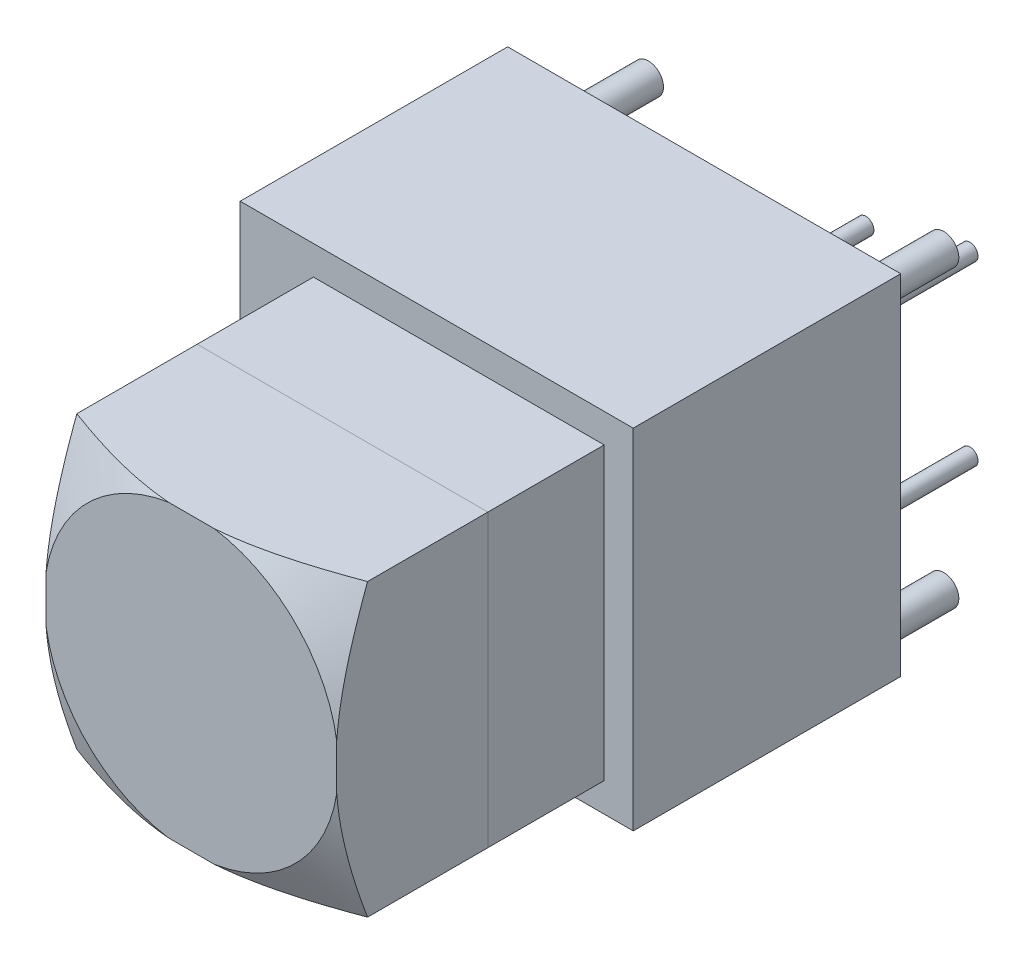
from build123d import *

# Parameters (mm, degrees)
SKETCH1_W           = 16.9
SKETCH1_H           = 15
BOSS_EXTRUDE1_DEPTH = 11.5
SKETCH3_R           = 0.65
BOSS_EXTRUDE2_DEPTH = 3
SKETCH3_3_R         = 0.35
BOSS_EXTRUDE3_DEPTH = 6
SKETCH6_W           = 12.5
SKETCH6_H           = 12.5
BOSS_EXTRUDE4_DEPTH = 5
SKETCH7_W           = 12.5
SKETCH7_H           = 12.5
BOSS_EXTRUDE5_DEPTH = 6.5


with BuildPart() as part:
    # Sketch1 → Boss-Extrude1 (new body)
    with BuildSketch(Plane.XY):
        Rectangle(SKETCH1_W, SKETCH1_H)
    extrude(amount=BOSS_EXTRUDE1_DEPTH)

    # Sketch3 → Boss-Extrude2 (add)
    with BuildSketch(Plane(origin=(0, 0, 0), x_dir=(-1, 0, 0), z_dir=(0, 0, -1))):
        with Locations((-7.3, -6.35)):
            Circle(SKETCH3_R)
        with Locations((-7.3, 6.35)):
            Circle(SKETCH3_R)
        with Locations((5.4, 6.35)):
            Circle(SKETCH3_R)
        with Locations((5.4, -6.35)):
            Circle(SKETCH3_R)
    extrude(amount=BOSS_EXTRUDE2_DEPTH)

    # Sketch3<3> → Boss-Extrude3 (add)
    with BuildSketch(Plane(origin=(0, 0, 0), x_dir=(-1, 0, 0), z_dir=(0, 0, -1))):
        with Locations((-5.425, 3.81)):
            Circle(SKETCH3_3_R)
        with Locations((-0.95, 2.54)):
            Circle(SKETCH3_3_R)
        with Locations((-0.95, 0)):
            Circle(SKETCH3_3_R)
        with Locations((-0.95, -2.54)):
            Circle(SKETCH3_3_R)
        with Locations((-5.425, -3.81)):
            Circle(SKETCH3_3_R)
    extrude(amount=BOSS_EXTRUDE3_DEPTH)

    # Sketch6 → Boss-Extrude4 (add)
    with BuildSketch(Plane.XY.offset(11.5)):
        with Locations((0.95, 0)):
            Rectangle(SKETCH6_W, SKETCH6_H)
    extrude(amount=BOSS_EXTRUDE4_DEPTH)


with BuildPart() as body_2:
    # Sketch7 → Boss-Extrude5 (new body)
    with BuildSketch(Plane.XY.offset(16.5)):
        with Locations((0.95, 0)):
            Rectangle(SKETCH7_W, SKETCH7_H)
    extrude(amount=BOSS_EXTRUDE5_DEPTH)

    # Sketch9 → Cut-Revolve1 (revolve, cut)
    with BuildSketch(Plane(origin=(0, 0, 0), x_dir=(1, 0, 0), z_dir=(0, 1, 0))):
        Polygon((-5.353275031, -23.012867052), (-10.018917376, -20.548337131), (-10.618952059, -23.756705478), align=None)
    revolve(axis=Axis((0.95, 0, 16.175), (0, 0, 1)), mode=Mode.SUBTRACT)


solid = Compound([part.part, body_2.part])
